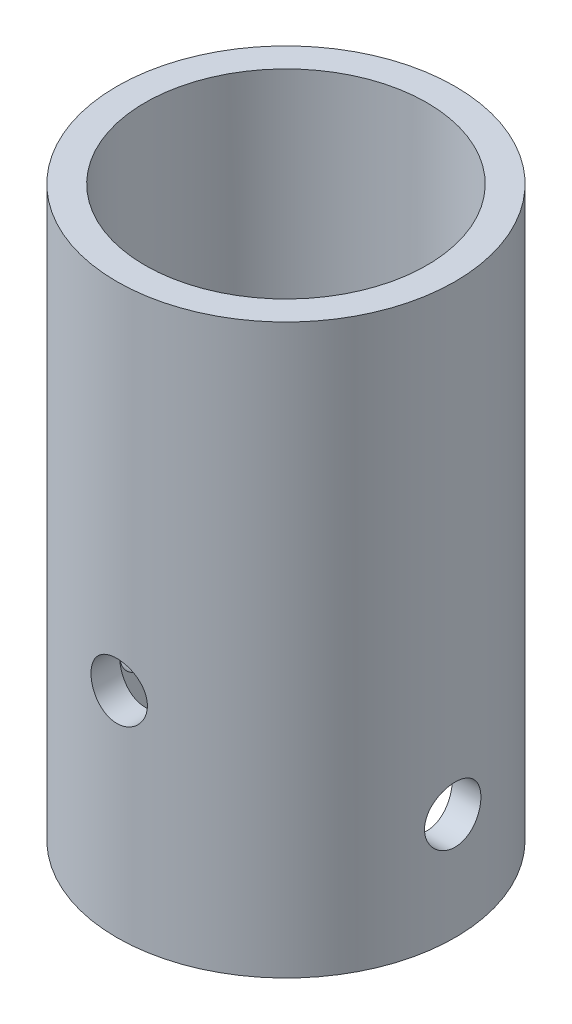
from build123d import *

# Parameters (mm, degrees)
BOSS_EXTRUDE1_DEPTH      = 20
BOSS_EXTRUDE1_DEPTH_BACK = 20
SKETCH1_R                = 9.525
SKETCH1_R_2              = 7.9375
BOSS_EXTRUDE2_DEPTH      = 0.5
BOSS_EXTRUDE2_DEPTH_BACK = 0.5
SKETCH2_R                = 7.9375
SKETCH2_R_2              = 7.178079091
CUT_EXTRUDE1_DEPTH       = 10
CUT_EXTRUDE1_DEPTH_BACK  = 10
SKETCH3_R                = 1.5875
CUT_EXTRUDE2_DEPTH       = 10
CUT_EXTRUDE2_DEPTH_BACK  = 10
SKETCH4_R                = 1.5875
SKETCH5_W                = 27.464518432
SKETCH5_H                = 24.266513238
CUT_EXTRUDE3_DEPTH       = 8


with BuildPart() as part:
    # Sketch1 → Boss-Extrude1 (new, two sides: drawn at the far end of the back side and taken through both)
    with BuildSketch(Plane(origin=(0, 0, 0), x_dir=(1, 0, 0), z_dir=(0, 1, 0)).offset(-BOSS_EXTRUDE1_DEPTH_BACK)):
        Circle(SKETCH1_R)
        Circle(SKETCH1_R_2, mode=Mode.SUBTRACT)
    extrude(amount=BOSS_EXTRUDE1_DEPTH + BOSS_EXTRUDE1_DEPTH_BACK)

    # Sketch2 → Boss-Extrude2 (add, two sides: drawn at the far end of the back side and taken through both)
    with BuildSketch(Plane(origin=(0, 0, 0), x_dir=(1, 0, 0), z_dir=(0, 1, 0)).offset(-BOSS_EXTRUDE2_DEPTH_BACK)):
        Circle(SKETCH2_R)
        Circle(SKETCH2_R_2, mode=Mode.SUBTRACT)
    extrude(amount=BOSS_EXTRUDE2_DEPTH + BOSS_EXTRUDE2_DEPTH_BACK)

    # Sketch3 → Cut-Extrude1 (cut, two sides: drawn at the far end of the back side and taken through both)
    with BuildSketch(Plane(origin=(0, 0, 0), x_dir=(0, 0, -1), z_dir=(1, 0, 0)).offset(-CUT_EXTRUDE1_DEPTH_BACK)):
        with Locations((0, -14)):
            Circle(SKETCH3_R)
    extrude(amount=CUT_EXTRUDE1_DEPTH + CUT_EXTRUDE1_DEPTH_BACK, mode=Mode.SUBTRACT)

    # Sketch4 → Cut-Extrude2 (cut, two sides: drawn at the far end of the back side and taken through both)
    with BuildSketch(Plane.XY.offset(-CUT_EXTRUDE2_DEPTH_BACK)):
        with Locations((0, -7.965)):
            Circle(SKETCH4_R)
    extrude(amount=CUT_EXTRUDE2_DEPTH + CUT_EXTRUDE2_DEPTH_BACK, mode=Mode.SUBTRACT)

    # Sketch5 → Cut-Extrude3 (cut)
    with BuildSketch(Plane(origin=(0, 20, 0), x_dir=(1, 0, 0), z_dir=(0, 1, 0))):
        Rectangle(SKETCH5_W, SKETCH5_H)
    extrude(amount=-CUT_EXTRUDE3_DEPTH, mode=Mode.SUBTRACT)


solid = part.part
